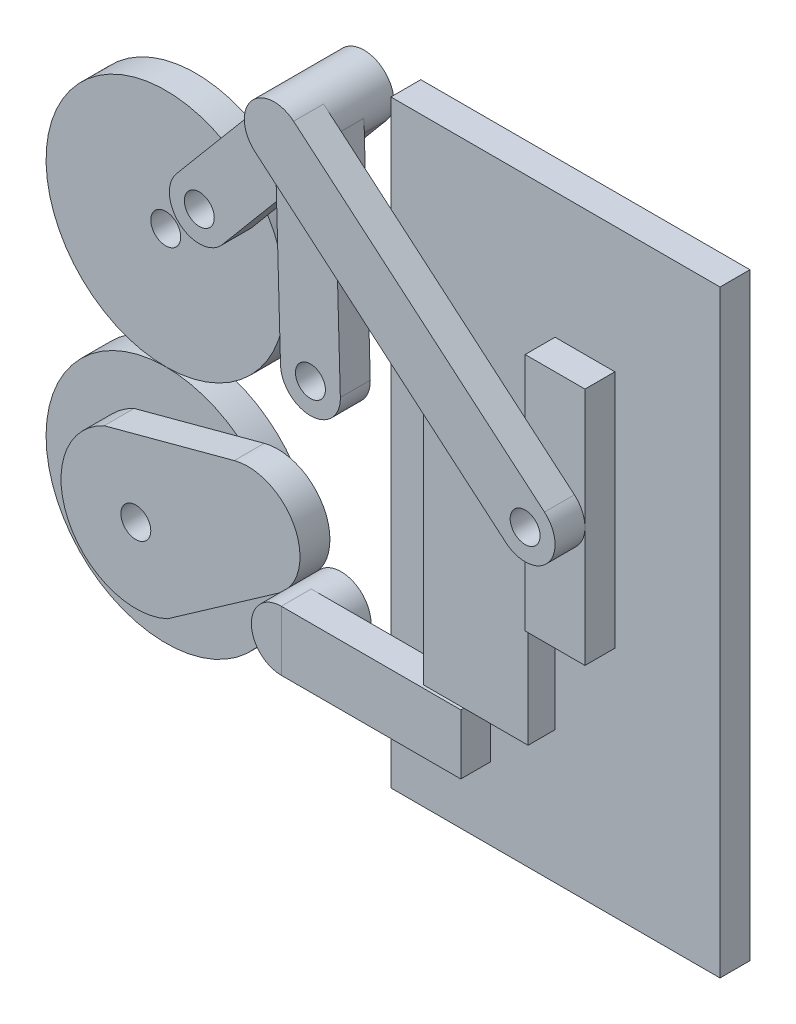
from build123d import *

# Parameters (mm, degrees)
SKETCH_1_R          = 40
EXTRUDE_1_DEPTH     = 10
SKETCH_2_R          = 40
EXTRUDE_2_DEPTH     = 10
EXTRUDE_3_DEPTH     = 10
EXTRUDE_START       = 10
SKETCH_4_R          = 10
EXTRUDE_4_DEPTH     = 20
SKETCH_5_W          = 60
SKETCH_5_H          = 20
EXTRUDE_5_DEPTH     = 10
SKETCH_6_R          = 5
CUT_EXTRUDE_1_DEPTH = 10
EXTRUDE_6_DEPTH     = 10
SKETCH_8_R          = 5
CUT_EXTRUDE_2_DEPTH = 10
EXTRUDE_7_DEPTH     = 10
EXTRUDE_9_DEPTH     = 10
SKETCH_12_R         = 5
CUT_EXTRUDE_3_DEPTH = 10
SKETCH_13_R         = 5
CUT_EXTRUDE_4_DEPTH = 10
SKETCH_14_R         = 5
CUT_EXTRUDE_5_DEPTH = 10
SKETCH_15_W         = 20
SKETCH_15_H         = 80
EXTRUDE_10_DEPTH    = 10
SKETCH_16_W         = 110
SKETCH_16_H         = 200
EXTRUDE_11_DEPTH    = 10
SKETCH_17_W         = 35
SKETCH_17_H         = 85
EXTRUDE_12_DEPTH    = 9
SKETCH_18_R         = 5
CUT_EXTRUDE_6_DEPTH = 10
SKETCH_19_R         = 5
CUT_EXTRUDE_7_DEPTH = 20


with BuildPart() as part:
    # 草图1 → 凸台-拉伸1 (new body)
    with BuildSketch(Plane.XY):
        Circle(SKETCH_1_R)
    extrude(amount=EXTRUDE_1_DEPTH)

    # 草图6 → 切除-拉伸1 (cut)
    with BuildSketch(Plane.XY.offset(10)):
        with Locations((21.213203436, 21.213203436)):
            Circle(SKETCH_6_R)
    extrude(amount=-CUT_EXTRUDE_1_DEPTH, mode=Mode.SUBTRACT)

    # 草图7 → 凸台-拉伸6 (add)
    with BuildSketch(Plane.XY.offset(10)):
        with BuildLine():
            Line((13.558194714, 27.647552002), (58.598634676, 81.232613054))
            ThreePointArc((58.598634676, 81.232613054), (72.687991964, 82.45327321), (73.90865212, 68.363915922))
            Line((73.90865212, 68.363915922), (28.868212157, 14.77885487))
            ThreePointArc((28.868212157, 14.77885487), (14.77885487, 13.558194714), (13.558194714, 27.647552002))
        make_face()
    extrude(amount=EXTRUDE_6_DEPTH)

    # 草图8 → 切除-拉伸2 (cut)
    with BuildSketch(Plane.XY.offset(20)):
        with Locations((66.253643398, 74.798264488)):
            Circle(SKETCH_8_R)
    extrude(amount=-CUT_EXTRUDE_2_DEPTH, mode=Mode.SUBTRACT)

    # 草图9 → 凸台-拉伸7 (add)
    with BuildSketch(Plane.XY.offset(20)):
        with BuildLine():
            Line((58.353926544, -0.280158249), (56.2575686, 74.518106239))
            ThreePointArc((56.2575686, 74.518106239), (65.973485149, 84.794339286), (76.249718195, 75.078422737))
            Line((76.249718195, 75.078422737), (78.346076139, 0.280158249))
            ThreePointArc((78.346076139, 0.280158249), (68.630159591, -9.996074797), (58.353926544, -0.280158249))
        make_face()
    extrude(amount=EXTRUDE_7_DEPTH)

    # 草图10 → 凸台-拉伸9 (add)
    with BuildSketch(Plane.XY.offset(30)):
        with BuildLine():
            Line((59.781263903, 67.175384214), (143.632946923, -4.020790225))
            ThreePointArc((143.632946923, -4.020790225), (157.728206692, -2.870289445), (156.577705912, 11.224970324))
            Line((156.577705912, 11.224970324), (72.726022892, 82.421144763))
            ThreePointArc((72.726022892, 82.421144763), (58.630763123, 81.270643983), (59.781263903, 67.175384214))
        make_face()
    extrude(amount=EXTRUDE_9_DEPTH)

    # 草图12 → 切除-拉伸3 (cut)
    with BuildSketch(Plane.XY.offset(30)):
        with Locations((68.350001342, 0)):
            Circle(SKETCH_12_R)
    extrude(amount=-CUT_EXTRUDE_3_DEPTH, mode=Mode.SUBTRACT)

    # 草图13 → 切除-拉伸4 (cut)
    with BuildSketch(Plane.XY.offset(20)):
        with Locations((21.213203436, 21.213203436)):
            Circle(SKETCH_13_R)
    extrude(amount=-CUT_EXTRUDE_4_DEPTH, mode=Mode.SUBTRACT)

    # 草图14 → 切除-拉伸5 (cut)
    with BuildSketch(Plane.XY.offset(40)):
        with Locations((150.105326418, 3.602090049)):
            Circle(SKETCH_14_R)
    extrude(amount=-CUT_EXTRUDE_5_DEPTH, mode=Mode.SUBTRACT)

    # 草图18 → 切除-拉伸6 (cut)
    with BuildSketch(Plane.XY.offset(10)):
        Circle(SKETCH_18_R)
    extrude(amount=-CUT_EXTRUDE_6_DEPTH, mode=Mode.SUBTRACT)


with BuildPart() as body_2:
    # 草图2 → 凸台-拉伸2 (new body)
    with BuildSketch(Plane.XY):
        with Locations((0, -80)):
            Circle(SKETCH_2_R)
    extrude(amount=EXTRUDE_2_DEPTH)

    # 草图3 → 凸台-拉伸3 (add)
    with BuildSketch(Plane.XY.offset(10)):
        with BuildLine():
            Line((-10.565456544, -57.342305324), (32.901205639, -45.695448294))
            ThreePointArc((32.901205639, -45.695448294), (53.233777088, -55.176682071), (47.427298537, -76.84675504))
            Line((47.427298537, -76.84675504), (10.565456544, -102.657694676))
            ThreePointArc((10.565456544, -102.657694676), (-22.657694676, -90.565456544), (-10.565456544, -57.342305324))
        make_face()
    extrude(amount=EXTRUDE_3_DEPTH)

    # 草图19 → 切除-拉伸7 (cut)
    with BuildSketch(Plane.XY.offset(20)):
        with Locations((0, -80)):
            Circle(SKETCH_19_R)
    extrude(amount=-CUT_EXTRUDE_7_DEPTH, mode=Mode.SUBTRACT)


with BuildPart() as body_3:
    # 草图4 → 凸台-拉伸4 (new body)
    with BuildSketch(Plane.XY.offset(EXTRUDE_START)):
        with Locations((58.610156078, -80)):
            Circle(SKETCH_4_R)
    extrude(amount=EXTRUDE_4_DEPTH)


with BuildPart() as body_4:
    # 草图5 → 凸台-拉伸5 (new body)
    with BuildSketch(Plane.XY.offset(30)):
        with Locations((88.610156078, -80)):
            Rectangle(SKETCH_5_W, SKETCH_5_H)
    extrude(amount=-EXTRUDE_5_DEPTH)


with BuildPart() as body_5:
    # 草图15 → 凸台-拉伸10 (new body)
    with BuildSketch(Plane(origin=(0, 0, 30), x_dir=(-1, 0, 0), z_dir=(0, 0, -1))):
        with Locations((-150.105326418, 3.602090049)):
            Rectangle(SKETCH_15_W, SKETCH_15_H)
    extrude(amount=EXTRUDE_10_DEPTH)


with BuildPart() as body_6:
    # 草图16 → 凸台-拉伸11 (new body)
    with BuildSketch(Plane(origin=(0, 0, 20), x_dir=(-1, 0, 0), z_dir=(0, 0, -1))):
        with Locations((-140.23897141, -14.288466448)):
            Rectangle(SKETCH_16_W, SKETCH_16_H)
    extrude(amount=EXTRUDE_11_DEPTH)

    # 草图17 → 凸台-拉伸12 (add)
    with BuildSketch(Plane.XY.offset(20)):
        with Locations((122.605326418, -27.5)):
            Rectangle(SKETCH_17_W, SKETCH_17_H)
    extrude(amount=EXTRUDE_12_DEPTH)


solid = Compound([part.part, body_2.part, body_3.part, body_4.part, body_5.part, body_6.part])
